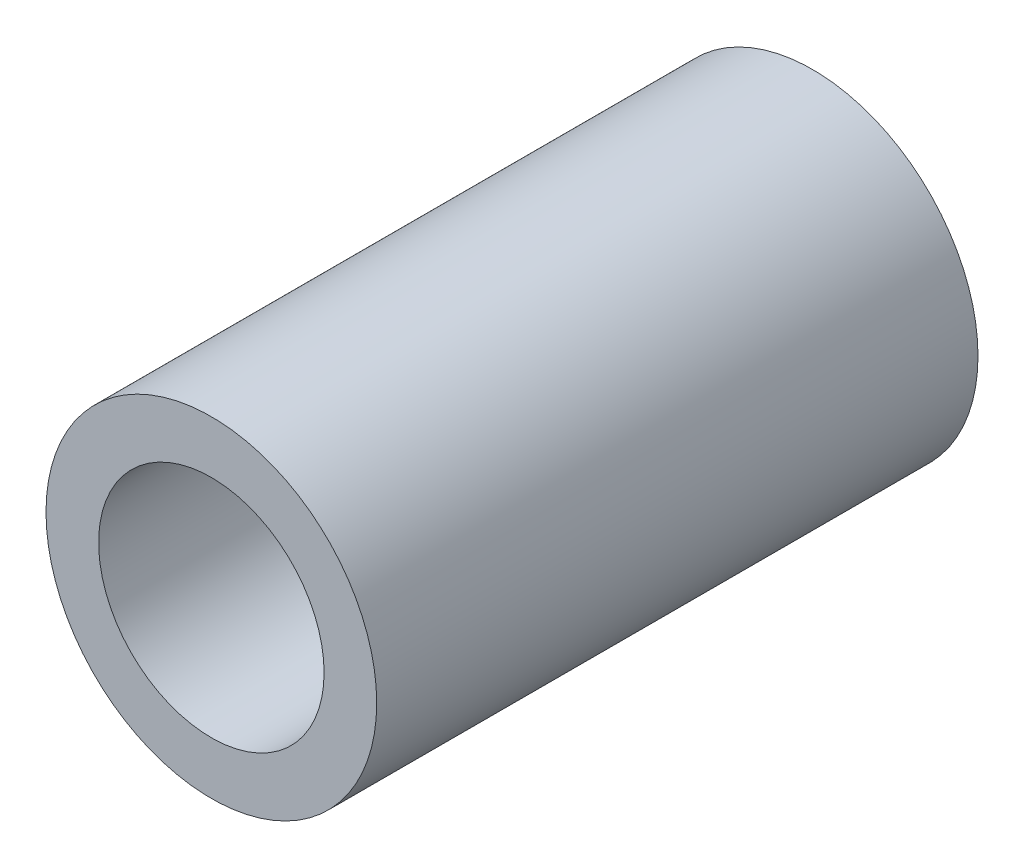
from build123d import *

# Parameters (mm, degrees)
SKETCH1_R           = 2.2
SKETCH1_R_2         = 1.5
BOSS_EXTRUDE1_DEPTH = 8


with BuildPart() as part:
    # Sketch1 → Boss-Extrude1 (new body)
    with BuildSketch(Plane.XY):
        with Locations((-42.149607094, 34.939805881)):
            Circle(SKETCH1_R)
        with Locations((-42.149607094, 34.939805881)):
            Circle(SKETCH1_R_2, mode=Mode.SUBTRACT)
    extrude(amount=BOSS_EXTRUDE1_DEPTH)


solid = part.part
